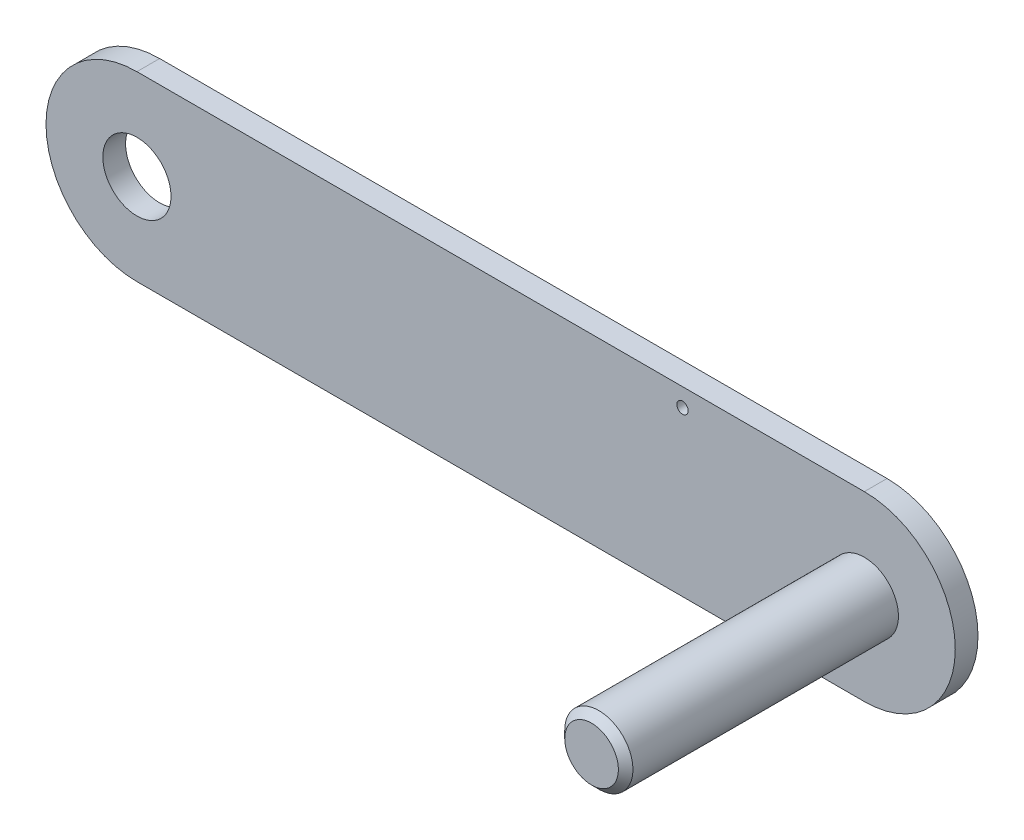
from build123d import *

# Parameters (mm, degrees)
SKETCH1_R           = 2.38125
BOSS_EXTRUDE1_DEPTH = 19.05
CHAMFER1_SIZE       = 0.508
SKETCH3_R           = 2.38125
BOSS_EXTRUDE2_DEPTH = 1.5875
SKETCH4_R           = 0.396875
CUT_EXTRUDE3_DEPTH  = 61.57513929


with BuildPart() as part:
    # Sketch1 → Boss-Extrude1 (new body)
    with BuildSketch(Plane.XY):
        with Locations(Location((0, 0, 0), (0, 0, 180))):
            Circle(SKETCH1_R)
    extrude(amount=BOSS_EXTRUDE1_DEPTH)

    # Chamfer1
    chamfer1_edges = [part.edges().sort_by_distance(p)[0] for p in [
        (2.38125, 0, 19.05),
    ]]
    chamfer(chamfer1_edges, length=CHAMFER1_SIZE)

    # Sketch3 → Boss-Extrude2 (add)
    with BuildSketch(Plane(origin=(0, 0, 0), x_dir=(-1, 0, 0), z_dir=(0, 0, -1))):
        with BuildLine():
            Line((0, 6.35), (50.8, 6.35))
            ThreePointArc((50.8, 6.35), (57.15, 0), (50.8, -6.35))
            Line((50.8, -6.35), (0, -6.35))
            ThreePointArc((0, -6.35), (-6.35, 0), (0, 6.35))
        make_face()
        with Locations((50.8, 0)):
            Circle(SKETCH3_R, mode=Mode.SUBTRACT)
    extrude(amount=BOSS_EXTRUDE2_DEPTH)

    # Sketch4 → Cut-Extrude3 (cut, through all)
    with BuildSketch(Plane.XY):
        with Locations((-12.7, 5.08)):
            Circle(SKETCH4_R)
    extrude(amount=-CUT_EXTRUDE3_DEPTH, mode=Mode.SUBTRACT)


solid = part.part
